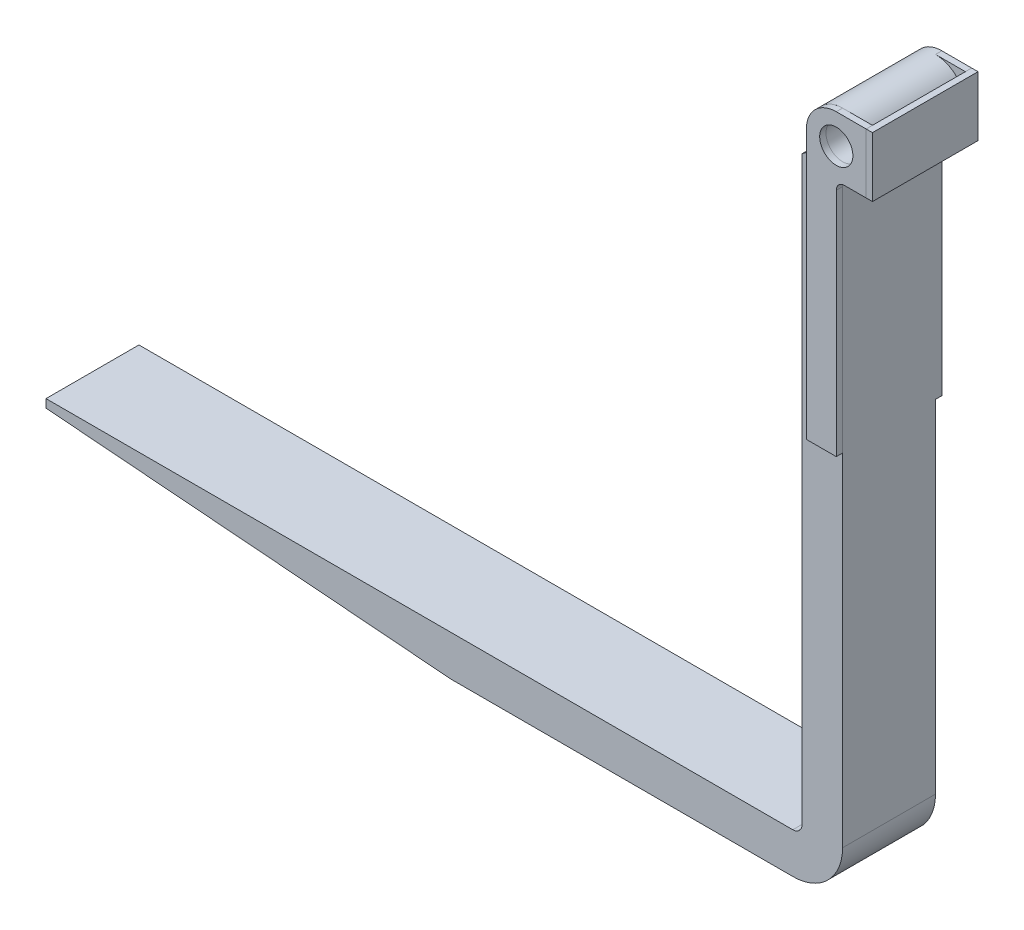
from build123d import *

# Parameters (mm, degrees)
EXTRUDE_THIN1_DEPTH     = 70
CUT_EXTRUDE1_DEPTH      = 1537.912489376
CUT_EXTRUDE1_DEPTH_BACK = 1537.912489376
SKETCH3_R               = 45
SKETCH3_R_2             = 25
BOSS_EXTRUDE1_DEPTH     = 70
BOSS_EXTRUDE2_DEPTH     = 70
SKETCH5_R               = 45
SKETCH5_R_2             = 25
BOSS_EXTRUDE3_DEPTH     = 9.5
SKETCH7_W               = 159
SKETCH7_H               = 90
BOSS_EXTRUDE5_DEPTH     = 9.5


with BuildPart() as part:
    # Sketch1 → Extrude-Thin1 (new, symmetric)
    with BuildSketch(Plane.XY):
        with BuildLine():
            Line((-1200, 0), (-75, 0))
            ThreePointArc((-75, 0), (-21.966991411, 21.966991411), (0, 75))
            Line((0, 75), (0, 950))
            Line((0, 950), (-61, 950))
            Line((-61, 950), (-61, 75))
            ThreePointArc((-61, 75), (-65.100505063, 65.100505063), (-75, 61))
            Line((-75, 61), (-1200, 61))
            Line((-1200, 61), (-1200, 0))
        make_face()
    extrude(amount=EXTRUDE_THIN1_DEPTH, both=True)

    # Sketch2 → Cut-Extrude1 (cut, two sides: drawn at the far end of the back side and taken through both)
    with BuildSketch(Plane.XY.offset(70).offset(-CUT_EXTRUDE1_DEPTH_BACK)):
        Polygon((-4202.326226889, 287.209544269), (-1200, 48.5), (-590, 0), (2412.326226889, -238.709544269), (1934.907138351, -6243.361998046), (-4679.745315427, -5717.442909508), align=None)
    extrude(amount=CUT_EXTRUDE1_DEPTH + CUT_EXTRUDE1_DEPTH_BACK, mode=Mode.SUBTRACT)


with BuildPart() as body_2:
    # Sketch3 → Boss-Extrude1 (new, symmetric)
    with BuildSketch(Plane.XY):
        with Locations((0, 995)):
            Circle(SKETCH3_R)
        with Locations((0, 995)):
            Circle(SKETCH3_R_2, mode=Mode.SUBTRACT)
    extrude(amount=BOSS_EXTRUDE1_DEPTH, both=True)


with BuildPart() as body_3:
    # Sketch4 → Boss-Extrude2 (new, symmetric)
    with BuildSketch(Plane.XY):
        with BuildLine():
            Line((-36.212585863, 968.285797314), (-61, 950))
            Line((-61, 950), (0, 950))
            ThreePointArc((0, 950), (-20.283748164, 954.830738612), (-36.212585863, 968.285797314))
        make_face()
    extrude(amount=BOSS_EXTRUDE2_DEPTH, both=True)


with BuildPart() as body_4:
    # Sketch5 → Boss-Extrude3 (new body)
    # profile 1 of 3: a face of its own
    with BuildSketch(Plane.XY.offset(70)):
        with Locations((0, 995)):
            Circle(SKETCH5_R)
        with Locations((0, 995)):
            Circle(SKETCH5_R_2, mode=Mode.SUBTRACT)
    # profile 2 of 3: a face of its own
    with BuildSketch(Plane.XY.offset(70)):
        with BuildLine():
            Line((45, 1040), (0, 1040))
            ThreePointArc((0, 1040), (31.819805153, 1026.819805153), (45, 995))
            Line((45, 995), (45, 1040))
        make_face()
    # profile 3 of 3: a face of its own
    with BuildSketch(Plane.XY.offset(70)):
        with BuildLine():
            ThreePointArc((45, 995), (0, 950), (-45, 995))
            Line((-45, 995), (-45, 590))
            Line((-45, 590), (0, 590))
            Line((0, 590), (0, 937.5))
            ThreePointArc((0, 937.5), (3.661165235, 946.338834765), (12.5, 950))
            Line((12.5, 950), (45, 950))
            Line((45, 950), (45, 995))
        make_face()
    boss_extrude3 = extrude(amount=BOSS_EXTRUDE3_DEPTH)


with BuildPart() as part_1:
    add(part.part)

    add(body_2.part)  # Mirror1 merges body 2

    add(body_3.part)  # Mirror1 merges body 3
    # Mirror1: Boss-Extrude3 across plane
    add(boss_extrude3.mirror(Plane.XY))


with BuildPart() as body_3_2:
    # Sketch7 → Boss-Extrude5 (new body)
    with BuildSketch(Plane(origin=(45, 0, 0), x_dir=(0, 0, -1), z_dir=(1, 0, 0))):
        with Locations((0, 995)):
            Rectangle(SKETCH7_W, SKETCH7_H)
    extrude(amount=BOSS_EXTRUDE5_DEPTH)


solid = Compound([body_4.part, part_1.part, body_3_2.part])
